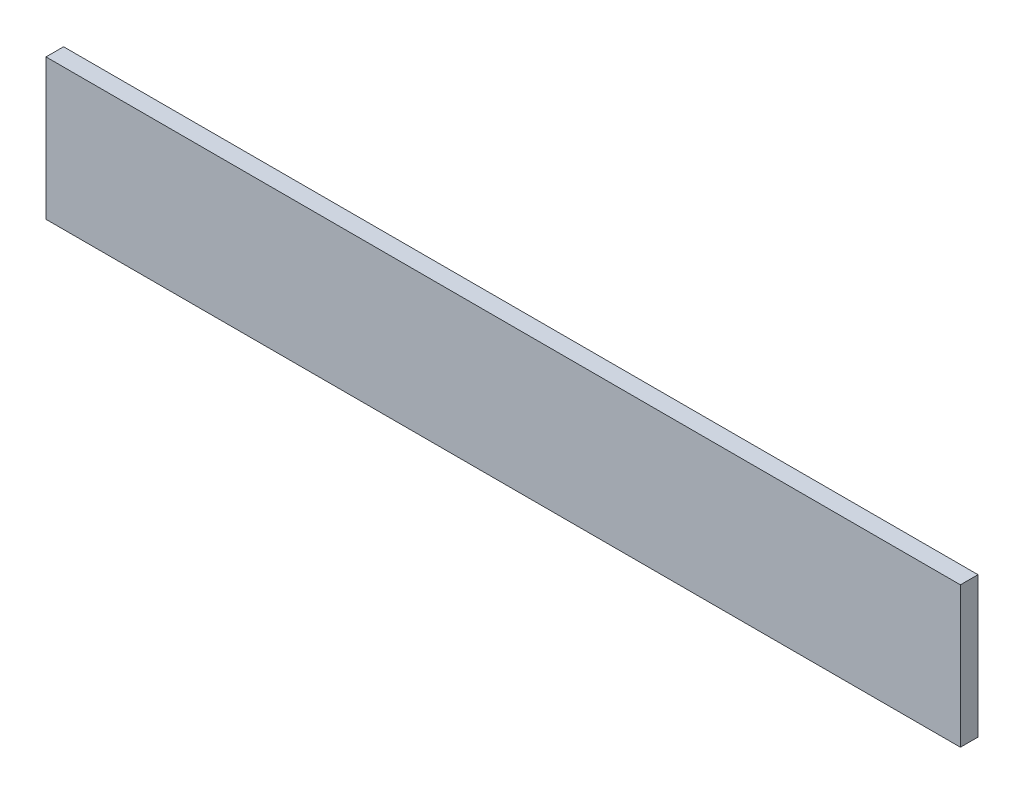
from build123d import *

# Parameters (mm, degrees)
SKETCH_1_W      = 26
SKETCH_1_H      = 4
EXTRUDE_1_DEPTH = 0.5


with BuildPart() as part:
    # 스케치1 → 보스-돌출1 (new body)
    with BuildSketch(Plane.XY):
        with Locations((17, -6)):
            Rectangle(SKETCH_1_W, SKETCH_1_H)
    extrude(amount=EXTRUDE_1_DEPTH)


solid = part.part
